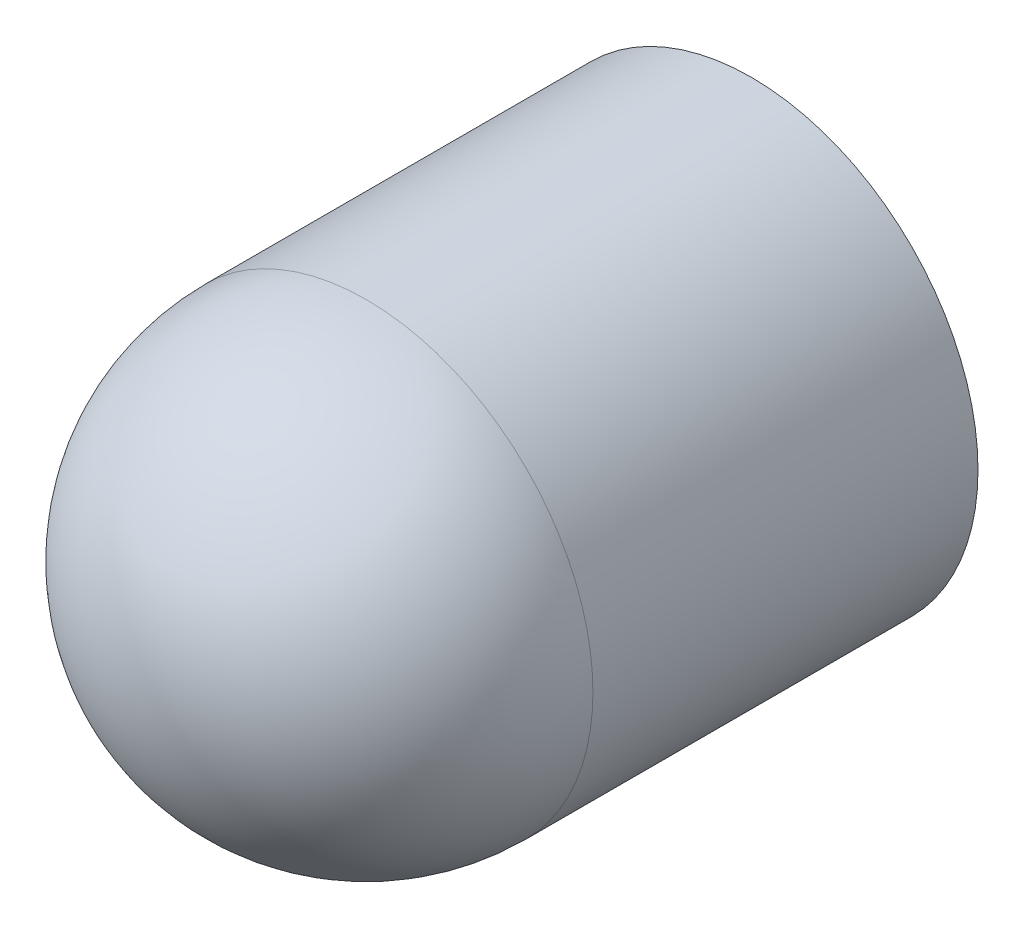
from build123d import *

# Parameters (mm, degrees)
SKETCH1_R           = 1.2
BOSS_EXTRUDE1_DEPTH = 2.038870263


with BuildPart() as part:
    # Sketch1 → Boss-Extrude1 (new body)
    with BuildSketch(Plane.XY):
        with Locations(Location((0, 0, 0), (0, 0, 180))):
            Circle(SKETCH1_R)
    extrude(amount=BOSS_EXTRUDE1_DEPTH)

    # Sketch3 → Revolve1 (revolve)
    with BuildSketch(Plane(origin=(0, 0, 0), x_dir=(1, 0, 0), z_dir=(0, 1, 0))):
        with BuildLine():
            Line((0, -2.038870263), (0, -3.238870263))
            ThreePointArc((0, -3.238870263), (0.848528137, -2.887398401), (1.2, -2.038870263))
            Line((1.2, -2.038870263), (0, -2.038870263))
        make_face()
    revolve(axis=Axis((0, 0, 2.038870263), (0, 0, 1)))


solid = part.part
